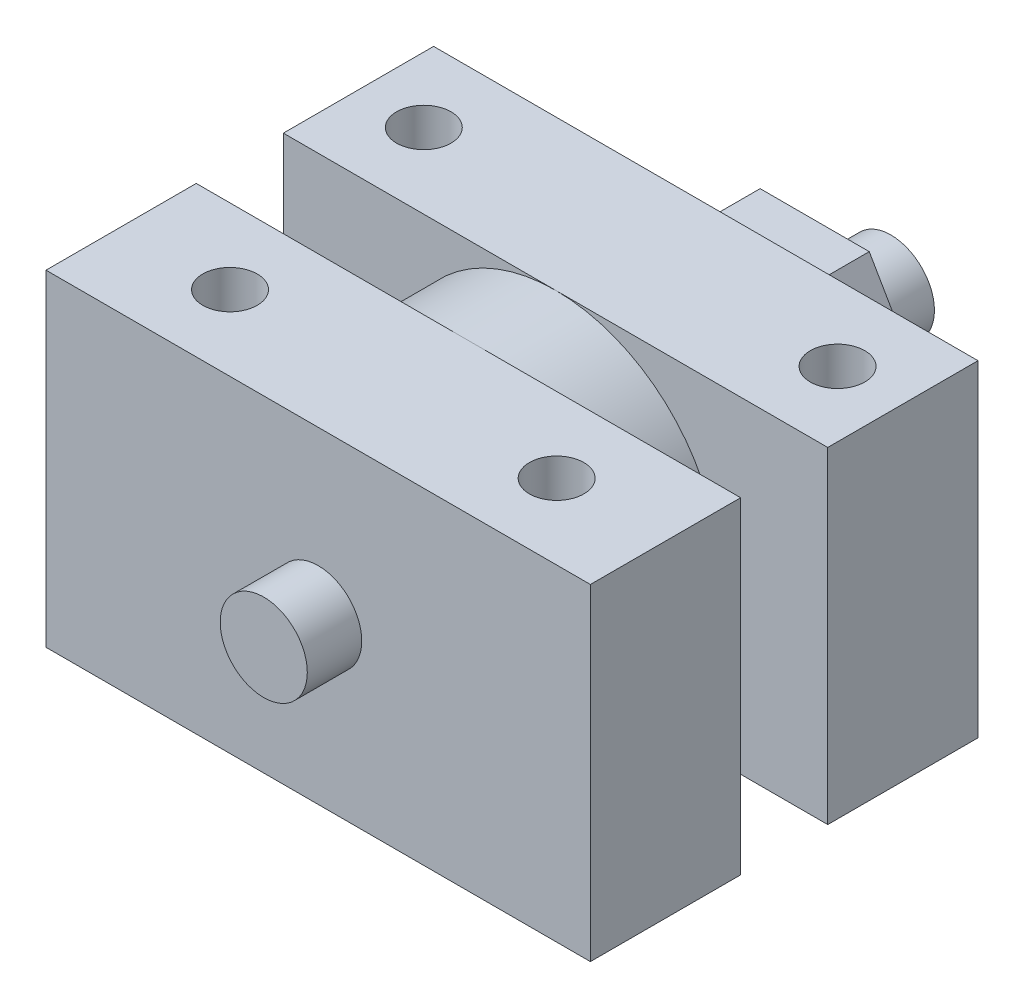
from build123d import *

# Parameters (mm, degrees)
SKETCH_1_W        = 50
SKETCH_1_H        = 13.8
SKETCH_1_R        = 2.5
EXTRUDE_1_DEPTH   = 15
EXTRUDE_1_2_DEPTH = 15
EXTRUDE_START     = -4
SKETCH_2_R        = 15
EXTRUDE_2_DEPTH   = 8
SKETCH_3_R        = 4
EXTRUDE_3_DEPTH   = 57.6
EXTRUDE_4_DEPTH   = 10


with BuildPart() as part:
    # 草图1 → 凸台-拉伸1 (new, symmetric)
    with BuildSketch(Plane(origin=(0, 0, 0), x_dir=(1, 0, 0), z_dir=(0, 1, 0))):
        with Locations((0, 10.9)):
            Rectangle(SKETCH_1_W, SKETCH_1_H)
        with Locations(Location((-19, 10.9, 0), (0, 0, 270))):
            Circle(SKETCH_1_R, mode=Mode.SUBTRACT)
        with Locations(Location((19, 10.9, 0), (0, 0, 270))):
            Circle(SKETCH_1_R, mode=Mode.SUBTRACT)
    extrude(amount=EXTRUDE_1_DEPTH, both=True)



with BuildPart() as body_2:
    # 草图1 → Extrude 1 2 (new, symmetric)
    with BuildSketch(Plane(origin=(0, 0, 0), x_dir=(1, 0, 0), z_dir=(0, 1, 0))):
        with Locations((0, -10.9)):
            Rectangle(SKETCH_1_W, SKETCH_1_H)
        with Locations(Location((15, -10.9, 0), (0, 0, 270))):
            Circle(SKETCH_1_R, mode=Mode.SUBTRACT)
        with Locations(Location((-15, -10.9, 0), (0, 0, 270))):
            Circle(SKETCH_1_R, mode=Mode.SUBTRACT)
    extrude(amount=EXTRUDE_1_2_DEPTH, both=True)


with BuildPart() as part_1:
    add(part.part)

    add(body_2.part)  # 凸台-拉伸2 merges body 2
    # 草图2 → 凸台-拉伸2 (add)
    with BuildSketch(Plane.XY.offset(EXTRUDE_START)):
        with Locations(Location((0, 0, 0), (0, 0, 90))):
            Circle(SKETCH_2_R)
    extrude(amount=EXTRUDE_2_DEPTH)

    # 草图3 → 凸台-拉伸3 (add)
    with BuildSketch(Plane.XY.offset(22.8)):
        Circle(SKETCH_3_R)
    extrude(amount=-EXTRUDE_3_DEPTH)

    # 草图4 → 凸台-拉伸4 (add)
    with BuildSketch(Plane(origin=(0, 0, -17.8), x_dir=(-1, 0, 0), z_dir=(0, 0, -1))):
        Polygon((-10.021943358, 0), (-5.010971679, -8.679257543), (5.010971679, -8.679257543), (10.021943358, 0), (5.010971679, 8.679257543), (-5.010971679, 8.679257543), align=None)
    extrude(amount=EXTRUDE_4_DEPTH)


solid = part_1.part
